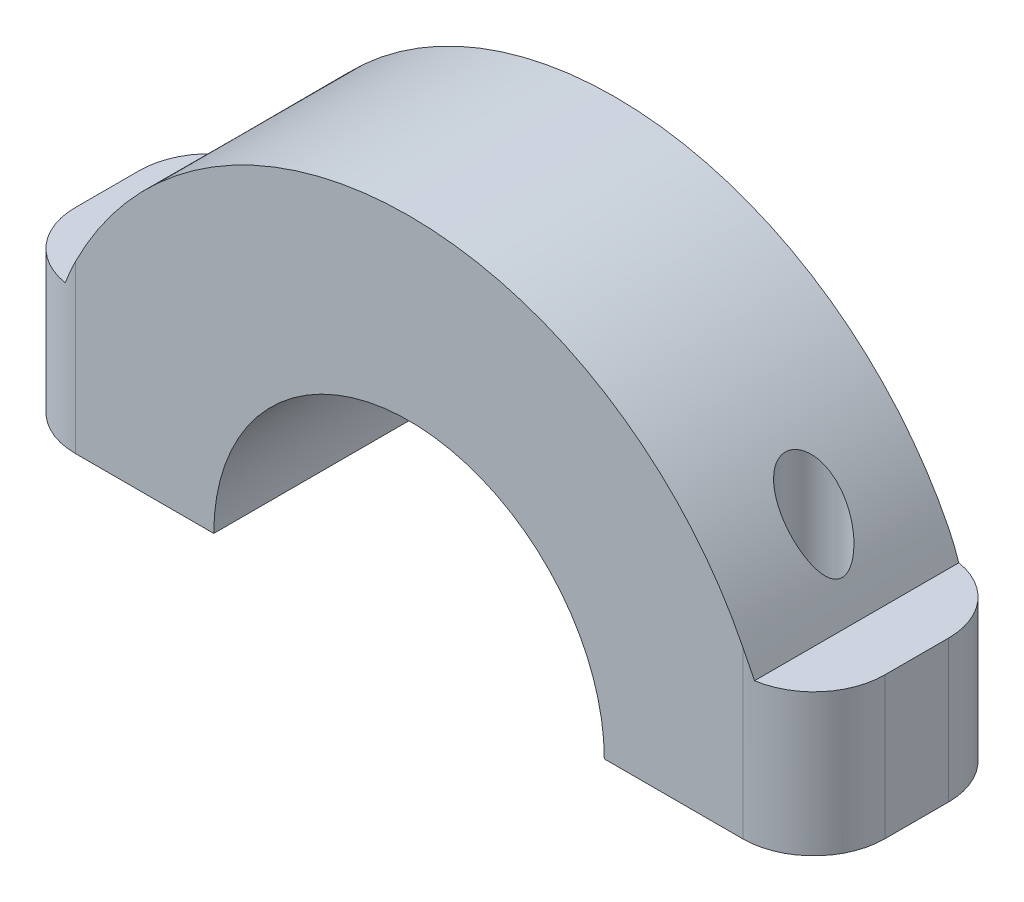
from build123d import *

# Parameters (mm, degrees)
SKETCH1_W             = 5.9
SKETCH1_H             = 5.8
BOSS_EXTRUDE1_DEPTH   = 4
BOSS_EXTRUDE2_DEPTH   = 5.8
FILLET1_R             = 2
M2X0_4_TAPPED_HOLE1_D = 1.6


with BuildPart() as part:
    # Sketch1 → Boss-Extrude1 (new body)
    with BuildSketch(Plane(origin=(0, 0, 0), x_dir=(1, 0, 0), z_dir=(0, 1, 0))):
        with Locations((-8.45, 0)):
            Rectangle(SKETCH1_W, SKETCH1_H)
    extrude(amount=BOSS_EXTRUDE1_DEPTH)

    # Sketch2 → Boss-Extrude2 (add)
    with BuildSketch(Plane.XY.offset(2.9)):
        with BuildLine():
            Line((-10.5, 0), (-5.5, 0))
            ThreePointArc((-5.5, 0), (0, 5.5), (5.5, 0))
            Line((5.5, 0), (10.5, 0))
            ThreePointArc((10.5, 0), (0, 10.5), (-10.5, 0))
        make_face()
    extrude(amount=-BOSS_EXTRUDE2_DEPTH)


with BuildPart() as body_2:
    # Mirror3: mirrored copy
    add(part.part.mirror(Plane(origin=(0, 0, 0), x_dir=(0, 0, 1), z_dir=(1, 0, 0))))


with BuildPart() as part_1:
    add(part.part)

    # Combine1: union body 2
    add(body_2.part)

    # Fillet1
    fillet1_edges = [part_1.edges().sort_by_distance(p)[0] for p in [
        (-11.4, 2, -2.9),
        (-11.4, 2, 2.9),
        (11.4, 2, -2.9),
        (11.4, 2, 2.9),
    ]]
    fillet(fillet1_edges, radius=FILLET1_R)

    # M2x0.4 Tapped Hole1 (through all)
    with Locations(Plane(origin=(0, 0, 0), x_dir=(-1, 0, 0), z_dir=(0, -1, 0))):
        with Locations((-8.5, 0), (8.5, 0)):
            Hole(M2X0_4_TAPPED_HOLE1_D / 2)


solid = part_1.part
